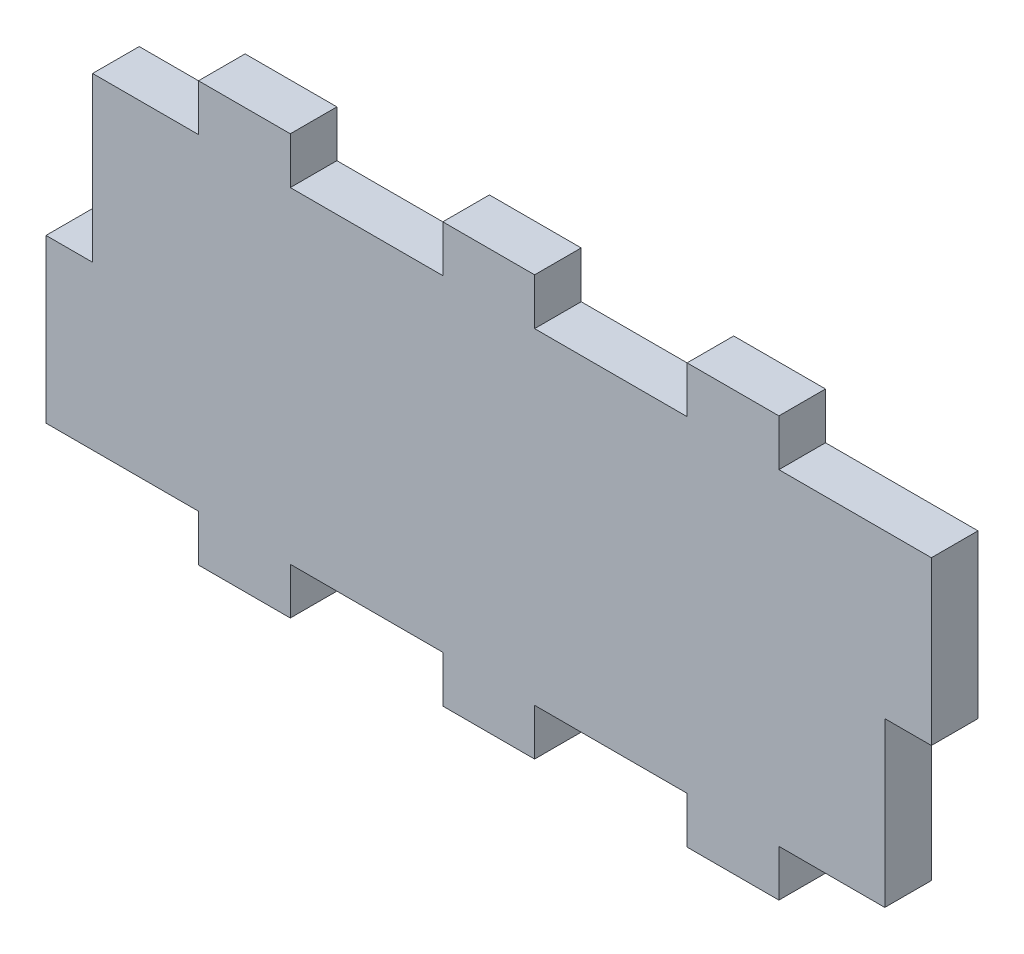
from build123d import *

# Parameters (mm, degrees)
SKETCH2_W           = 85
SKETCH2_H           = 35
SKETCH2_W_2         = 5
SKETCH2_H_2         = 17.45
SKETCH2_W_3         = 9.85
SKETCH2_H_3         = 5
BOSS_EXTRUDE1_DEPTH = 5


with BuildPart() as part:
    # Sketch2 → Boss-Extrude1 (new body)
    with BuildSketch(Plane.XY):
        Rectangle(SKETCH2_W, SKETCH2_H)
        with Locations((-45, -8.775)):
            Rectangle(SKETCH2_W_2, SKETCH2_H_2)
        with Locations((-26.2125, 20)):
            Rectangle(SKETCH2_W_3, SKETCH2_H_3)
        with Locations((0, 20)):
            Rectangle(SKETCH2_W_3, SKETCH2_H_3)
        with Locations((26.2125, 20)):
            Rectangle(SKETCH2_W_3, SKETCH2_H_3)
        with Locations((45, 8.775)):
            Rectangle(SKETCH2_W_2, SKETCH2_H_2)
        with Locations((26.2125, -20)):
            Rectangle(SKETCH2_W_3, SKETCH2_H_3)
        with Locations((0, -20)):
            Rectangle(SKETCH2_W_3, SKETCH2_H_3)
        with Locations((-26.2125, -20)):
            Rectangle(SKETCH2_W_3, SKETCH2_H_3)
    extrude(amount=BOSS_EXTRUDE1_DEPTH)


solid = part.part
